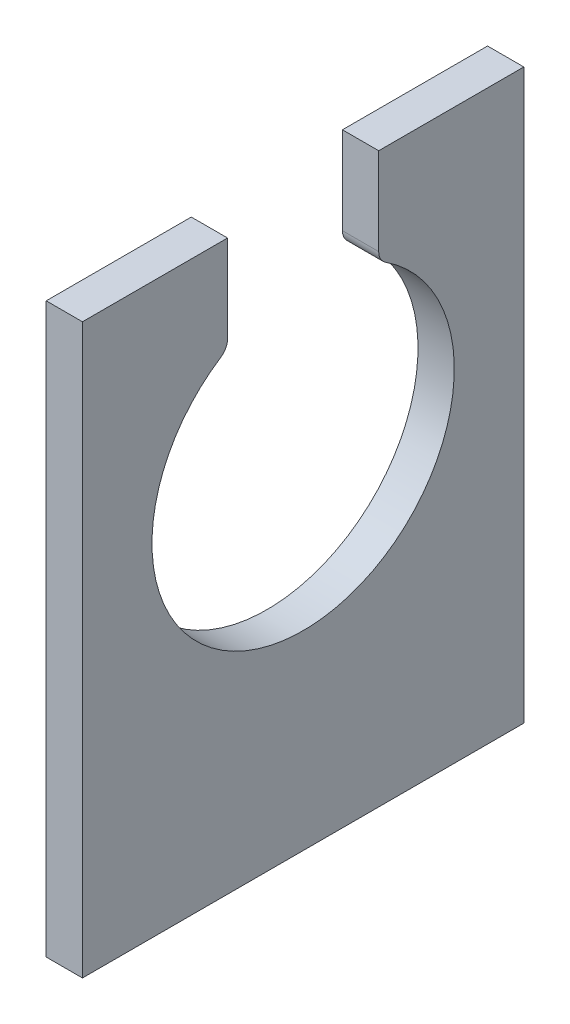
from build123d import *

# Parameters (mm, degrees)
BOSS_EXTRUDE1_DEPTH = 12


with BuildPart() as part:
    # Sketch1 → Boss-Extrude1 (new body)
    with BuildSketch(Plane(origin=(0, 0, 0), x_dir=(0, 0, -1), z_dir=(1, 0, 0))):
        with BuildLine():
            Line((73, 94), (25, 94))
            Line((25, 94), (25, 65.097722286))
            ThreePointArc((25, 65.097722286), (25.604754635, 62.714065813), (27.272727273, 60.90702026))
            ThreePointArc((27.272727273, 60.90702026), (0, -31), (-27.272727273, 60.90702026))
            ThreePointArc((-27.272727273, 60.90702026), (-25.604754635, 62.714065813), (-25, 65.097722286))
            Line((-25, 65.097722286), (-25, 94))
            Line((-25, 94), (-73, 94))
            Line((-73, 94), (-73, -94))
            Line((-73, -94), (73, -94))
            Line((73, -94), (73, 94))
        make_face()
    extrude(amount=BOSS_EXTRUDE1_DEPTH)


solid = part.part
